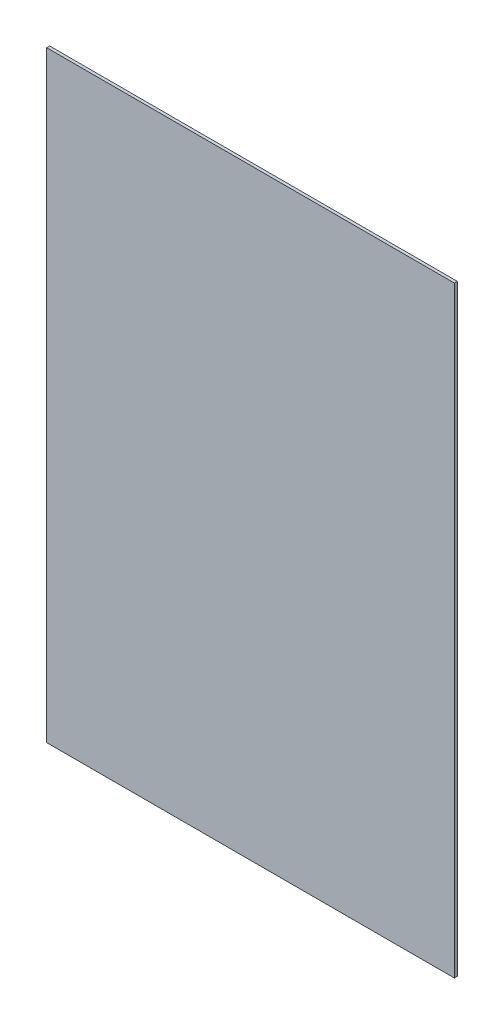
from build123d import *

# Parameters (mm, degrees)
SKETCH2_W           = 1380
SKETCH2_H           = 2037.7
BOSS_EXTRUDE2_DEPTH = 10


with BuildPart() as part:
    # Sketch2 → Boss-Extrude2 (new body)
    with BuildSketch(Plane.XY):
        with Locations((32.003710575, -607.922356215)):
            Rectangle(SKETCH2_W, SKETCH2_H)
    extrude(amount=BOSS_EXTRUDE2_DEPTH)


solid = part.part
